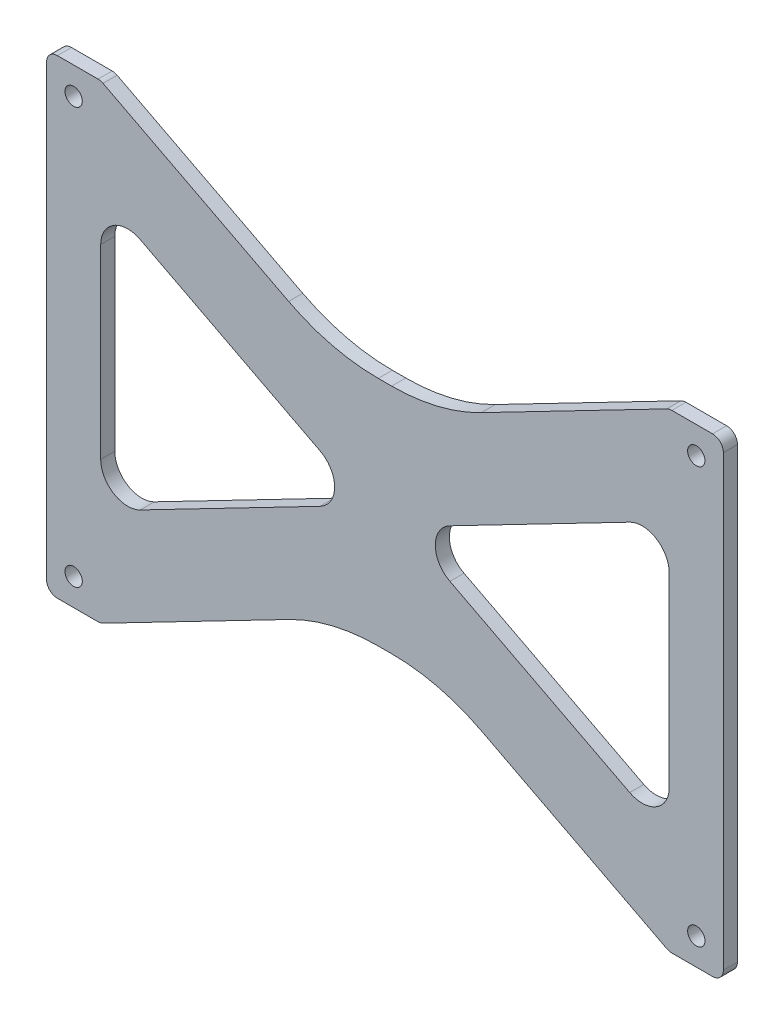
from build123d import *

# Parameters (mm, degrees)
SKETCH1_R           = 2.032
BOSS_EXTRUDE1_DEPTH = 3.302
FILLET1_R           = 45.72
FILLET2_R           = 2.54
CUT_EXTRUDE1_DEPTH  = 106.174191833
FILLET3_R           = 6.35


with BuildPart() as part:
    # Sketch1 → Boss-Extrude1 (new body)
    with BuildSketch(Plane.XY):
        Polygon((-79.375, 68.922542022), (-79.375, -41.313457978), (-66.675, -41.313457978), (-12.7, -13.38067482), (12.7, -13.38067482), (66.675, -41.313457978), (79.375, -41.313457978), (79.375, 68.922542022), (66.675, 68.922542022), (12.7, 40.989758863), (-12.7, 40.989758863), (-66.675, 68.922542022), align=None)
        with Locations(Location((-73.025, 62.572542022, 0), (0, 0, 180))):
            Circle(SKETCH1_R, mode=Mode.SUBTRACT)
        with Locations(Location((-73.025, -34.963457978, 0), (0, 0, 180))):
            Circle(SKETCH1_R, mode=Mode.SUBTRACT)
        with Locations(Location((73.025, -34.963457978, 0), (0, 0, 180))):
            Circle(SKETCH1_R, mode=Mode.SUBTRACT)
        with Locations(Location((73.025, 62.572542022, 0), (0, 0, 180))):
            Circle(SKETCH1_R, mode=Mode.SUBTRACT)
    extrude(amount=BOSS_EXTRUDE1_DEPTH)

    # Fillet1
    fillet1_edges = [part.edges().sort_by_distance(p)[0] for p in [
        (-12.7, 40.989758863, 1.651),
        (12.7, 40.989758863, 1.651),
        (12.7, -13.38067482, 1.651),
        (-12.7, -13.38067482, 1.651),
    ]]
    fillet(fillet1_edges, radius=FILLET1_R)

    # Fillet2
    fillet2_edges = [part.edges().sort_by_distance(p)[0] for p in [
        (-66.675, 68.922542022, 1.651),
        (66.675, 68.922542022, 1.651),
        (79.375, 68.922542022, 1.651),
        (79.375, -41.313457978, 1.651),
        (66.675, -41.313457978, 1.651),
        (-66.675, -41.313457978, 1.651),
        (-79.375, -41.313457978, 1.651),
        (-79.375, 68.922542022, 1.651),
    ]]
    fillet(fillet2_edges, radius=FILLET2_R)

    # Sketch2 → Cut-Extrude1 (cut, through all)
    with BuildSketch(Plane.XY.offset(3.302)):
        Polygon((-66.675, 46.062542022), (-66.675, -18.453457978), (-4.342308693, 13.804542022), align=None)
        Polygon((66.675, 46.062542022), (66.675, -18.453457978), (4.342308693, 13.804542022), align=None)
    extrude(amount=-CUT_EXTRUDE1_DEPTH, mode=Mode.SUBTRACT)

    # Fillet3
    fillet3_edges = [part.edges().sort_by_distance(p)[0] for p in [
        (-4.342308693, 13.804542022, 1.651),
        (-66.675, -18.453457978, 1.651),
        (-66.675, 46.062542022, 1.651),
        (4.342308693, 13.804542022, 1.651),
        (66.675, 46.062542022, 1.651),
        (66.675, -18.453457978, 1.651),
    ]]
    fillet(fillet3_edges, radius=FILLET3_R)


solid = part.part
